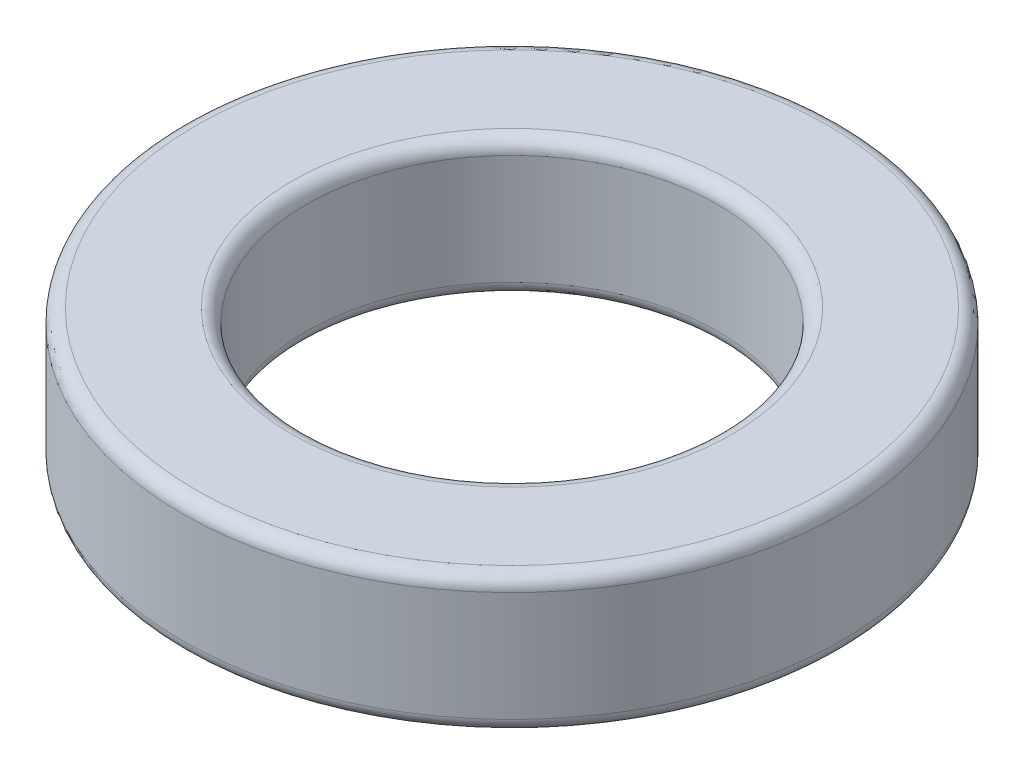
from build123d import *


with BuildPart() as part:
    # Sketch1 → Revolve1 (revolve)
    with BuildSketch(Plane(origin=(0, 0, 0), x_dir=(-1, 0, 0), z_dir=(0, 0, -1)), mode=Mode.PRIVATE) as revolve1_sk:
        with BuildLine():
            Line((-12, -0.5), (-12, -4.5))
            ThreePointArc((-12, -4.5), (-11.853553391, -4.853553391), (-11.5, -5))
            Line((-11.5, -5), (-8, -5))
            ThreePointArc((-8, -5), (-7.646446609, -4.853553391), (-7.5, -4.5))
            Line((-7.5, -4.5), (-7.5, -0.5))
            ThreePointArc((-7.5, -0.5), (-7.646446609, -0.146446609), (-8, 0))
            Line((-8, 0), (-11.5, 0))
            ThreePointArc((-11.5, 0), (-11.853553391, -0.146446609), (-12, -0.5))
        make_face()
    revolve(revolve1_sk.sketch.rotate(Axis((0, -5, 0), (0, 1, 0)), 270), axis=Axis((0, -5, 0), (0, 1, 0)))


solid = part.part
